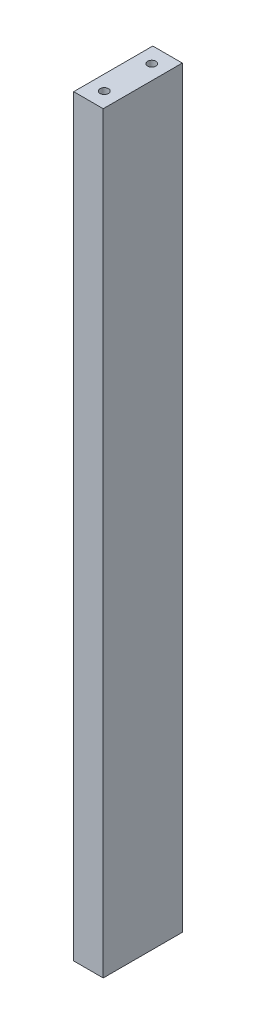
from build123d import *

# Parameters (mm, degrees)
SKETCH1_W           = 28
SKETCH1_H           = 75
LEFT_HAND_END_DEPTH = 714
SKETCH2_R           = 4
EXTRUDE1_DEPTH      = 10
EXTRUDE2_START      = 10
SKETCH3_R           = 4
EXTRUDE2_DEPTH      = 10


with BuildPart() as part:
    # Sketch1 → Left Hand End (new body)
    with BuildSketch(Plane(origin=(0, -714, 0), x_dir=(-1, 0, 0), z_dir=(0, 1, 0))):
        with Locations((14, -37.5)):
            Rectangle(SKETCH1_W, SKETCH1_H)
    extrude(amount=LEFT_HAND_END_DEPTH)

    # Sketch2 → Extrude1 (cut)
    with BuildSketch(Plane(origin=(0, 0, 0), x_dir=(1, 0, 0), z_dir=(0, 1, 0))):
        with Locations(Location((-14, 15, 0), (0, 0, 270))):
            Circle(SKETCH2_R)
        with Locations(Location((-14, 60, 0), (0, 0, 270))):
            Circle(SKETCH2_R)
    extrude(amount=-EXTRUDE1_DEPTH, mode=Mode.SUBTRACT)

    # Sketch3 → Extrude2 (cut)
    with BuildSketch(Plane(origin=(0, -714, 0), x_dir=(-1, 0, 0), z_dir=(0, 1, 0)).offset(EXTRUDE2_START)):
        with Locations(Location((14, -60, 0), (0, 0, 90))):
            Circle(SKETCH3_R)
        with Locations(Location((14, -15, 0), (0, 0, 90))):
            Circle(SKETCH3_R)
    extrude(amount=-EXTRUDE2_DEPTH, mode=Mode.SUBTRACT)


solid = part.part
